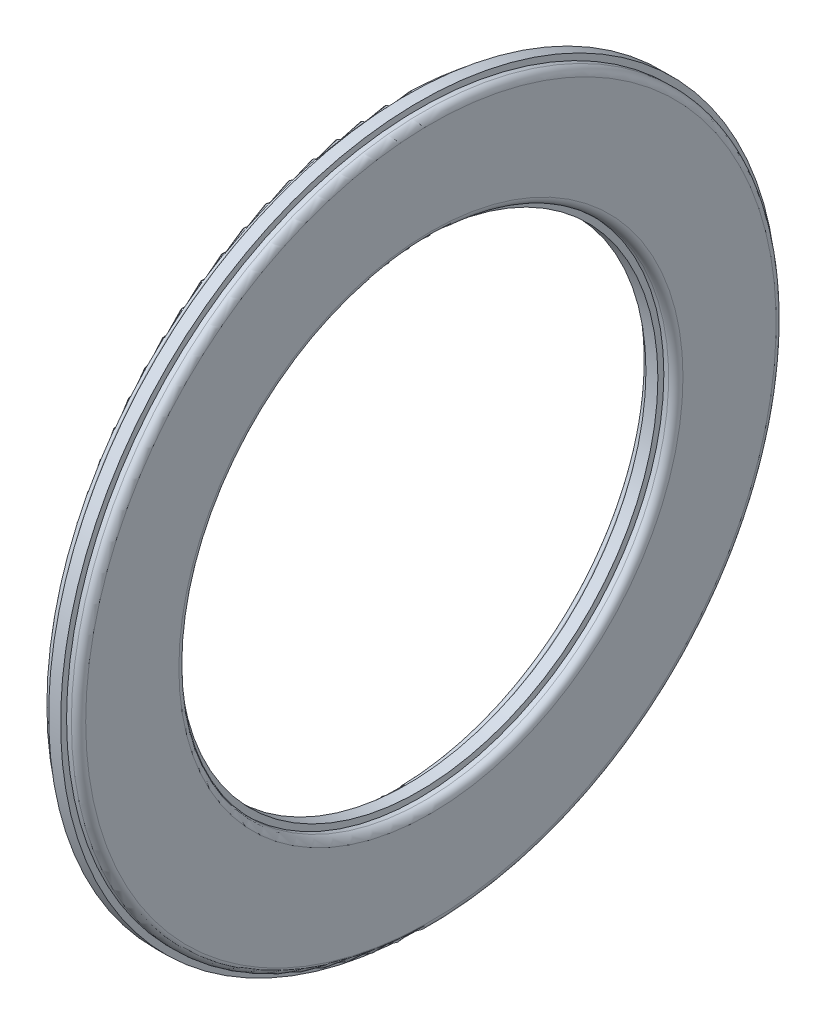
from build123d import *

# Parameters (mm, degrees)
CAGSPISKE_W = 1
CAGSPISKE_H = 10


with BuildPart() as part:
    # CagSpiSke → CageSpine (revolve)
    with BuildSketch(Plane.XY):
        with Locations((0, 25)):
            Rectangle(CAGSPISKE_W, CAGSPISKE_H)
    revolve(axis=Axis((-34.925, 0, 0), (1, 0, 0)))

    # RolSimSke → RollersSimplified (revolve)
    with BuildSketch(Plane.XY):
        with BuildLine():
            Line((-0.9, 29.5), (0.9, 29.5))
            ThreePointArc((0.9, 29.5), (1.324264069, 29.324264069), (1.5, 28.9))
            Line((1.5, 28.9), (1.5, 21.1))
            ThreePointArc((1.5, 21.1), (1.324264069, 20.675735931), (0.9, 20.5))
            Line((0.9, 20.5), (-0.9, 20.5))
            ThreePointArc((-0.9, 20.5), (-1.324264069, 20.675735931), (-1.5, 21.1))
            Line((-1.5, 21.1), (-1.5, 28.9))
            ThreePointArc((-1.5, 28.9), (-1.324264069, 29.324264069), (-0.9, 29.5))
        make_face()
    revolve(axis=Axis((-17.78, 0, 0), (1, 0, 0)))


solid = part.part
